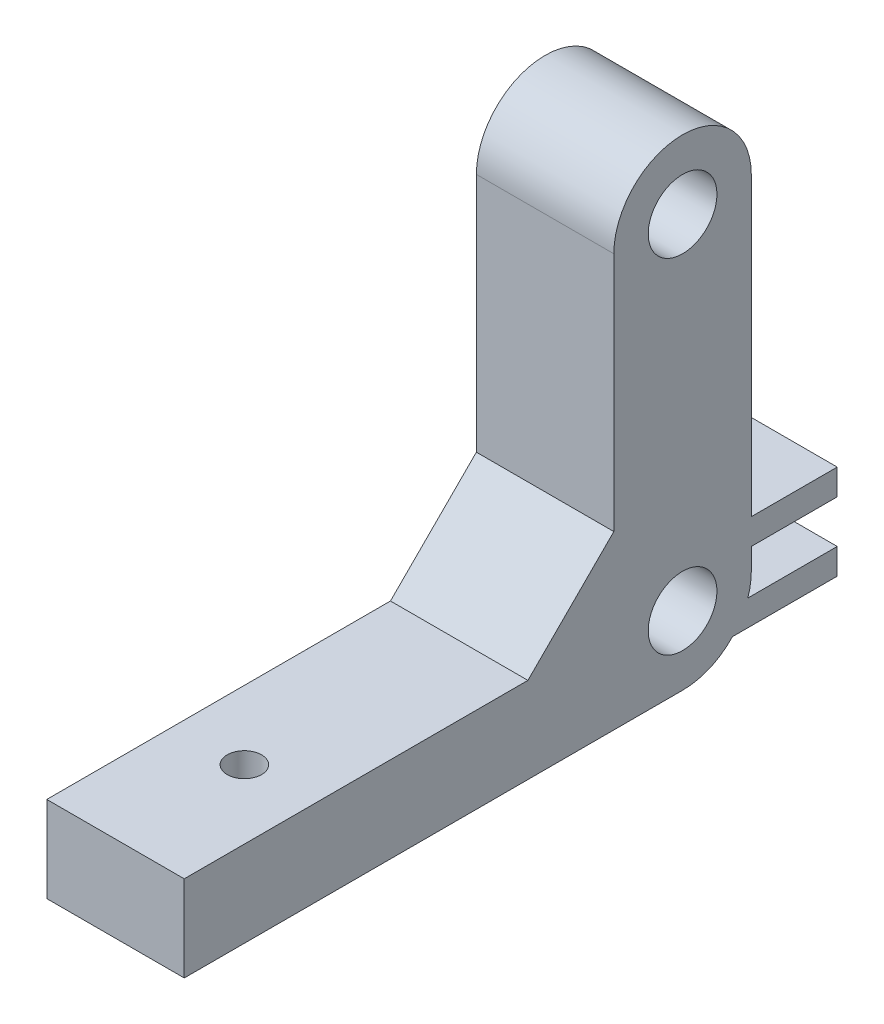
from build123d import *

# Parameters (mm, degrees)
SKETCH1_R           = 4
BOSS_EXTRUDE1_DEPTH = 16
SKETCH2_R           = 2
CUT_EXTRUDE1_DEPTH  = 77.491311533
SKETCH3_R           = 1.5
CUT_EXTRUDE2_DEPTH  = 75.439040429


with BuildPart() as part:
    # Sketch1 → Boss-Extrude1 (new body)
    with BuildSketch(Plane(origin=(0, 0, 0), x_dir=(0, 0, -1), z_dir=(1, 0, 0))):
        with BuildLine():
            Line((-10.309088451, -58.789851982), (-58.982376521, -58.789851982))
            Line((-58.982376521, -58.789851982), (-58.982376521, -48.789851982))
            Line((-58.982376521, -48.789851982), (-18.982376521, -48.789851982))
            Line((-18.982376521, -48.789851982), (-8.982376521, -38.789851982))
            Line((-8.982376521, -38.789851982), (-8.982376521, -10.789851982))
            ThreePointArc((-8.982376521, -10.789851982), (-0.982376521, -2.789851982), (7.017623479, -10.789851982))
            Line((7.017623479, -10.789851982), (7.017623479, -45.289851982))
            Line((7.017623479, -45.289851982), (17.017623479, -45.289851982))
            Line((17.017623479, -45.289851982), (17.017623479, -48.289851982))
            Line((17.017623479, -48.289851982), (7.017623479, -48.289851982))
            Line((7.017623479, -48.289851982), (7.017623479, -50.789851982))
            ThreePointArc((7.017623479, -50.789851982), (6.916823965, -52.055802887), (6.616965556, -53.289851982))
            Line((6.616965556, -53.289851982), (17.017623479, -53.289851982))
            Line((17.017623479, -53.289851982), (17.017623479, -56.289851982))
            Line((17.017623479, -56.289851982), (4.827098499, -56.289851982))
            ThreePointArc((4.827098499, -56.289851982), (2.179901139, -58.138321211), (-0.982376521, -58.789851982))
            Line((-0.982376521, -58.789851982), (-10.309088451, -58.789851982))
        make_face()
        with Locations((-0.982376521, -10.789851982)):
            Circle(SKETCH1_R, mode=Mode.SUBTRACT)
        with Locations((-0.982376521, -50.789851982)):
            Circle(SKETCH1_R, mode=Mode.SUBTRACT)
    extrude(amount=-BOSS_EXTRUDE1_DEPTH)

    # Sketch2 → Cut-Extrude1 (cut, through all)
    with BuildSketch(Plane(origin=(0, -48.789851982, 0), x_dir=(1, 0, 0), z_dir=(0, 1, 0))):
        with Locations(Location((-8, -43.982376521, 0), (0, 0, 270))):
            Circle(SKETCH2_R)
    extrude(amount=-CUT_EXTRUDE1_DEPTH, mode=Mode.SUBTRACT)

    # Sketch3 → Cut-Extrude2 (cut, through all)
    with BuildSketch(Plane(origin=(0, -45.289851982, 0), x_dir=(1, 0, 0), z_dir=(0, 1, 0))):
        with Locations(Location((-8, 12.017623479, 0), (0, 0, 270))):
            Circle(SKETCH3_R)
    extrude(amount=-CUT_EXTRUDE2_DEPTH, mode=Mode.SUBTRACT)


solid = part.part
